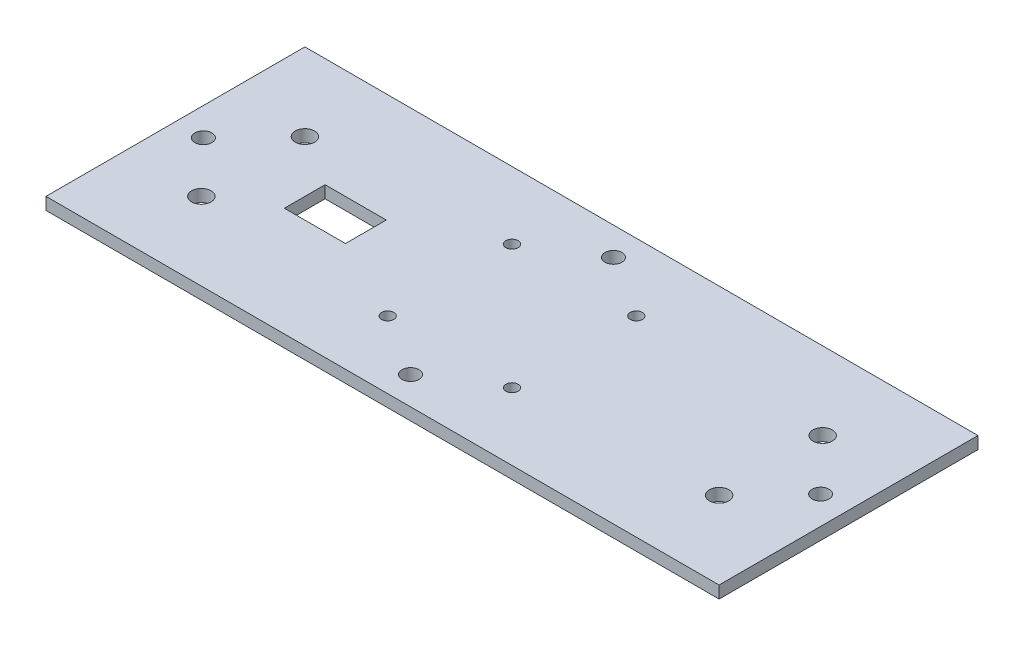
from build123d import *

# Parameters (mm, degrees)
SKETCH1_W           = 165.1
SKETCH1_H           = 63.5
BOSS_EXTRUDE1_DEPTH = 3
CUT_EXTRUDE1_REACH  = 90.496
SKETCH6_R           = 1.5
SKETCH6_W           = 15
SKETCH6_H           = 10
CUT_EXTRUDE3_REACH  = 90.496
SKETCH8_R           = 2.38125
SKETCH9_R           = 2.0828
CUT_EXTRUDE5_DEPTH  = 5.08
SKETCH10_R          = 2.0828
CUT_EXTRUDE6_DEPTH  = 5.08


with BuildPart() as part:
    # Sketch1 → Boss-Extrude1 (new body)
    with BuildSketch(Plane(origin=(0, 0, 0), x_dir=(1, 0, 0), z_dir=(0, 1, 0))):
        Rectangle(SKETCH1_W, SKETCH1_H)
    extrude(amount=BOSS_EXTRUDE1_DEPTH)

    # Sketch6 → Cut-Extrude1 (cut, up to next)
    with BuildSketch(Plane.XZ, mode=Mode.PRIVATE) as cut_extrude1_sk1:
        with Locations(Location((-15.25, 15.25, 0), (0, 0, 270))):
            Circle(SKETCH6_R)
    cut_extrude1_tool1 = extrude(cut_extrude1_sk1.sketch, amount=-CUT_EXTRUDE1_REACH, mode=Mode.PRIVATE) & part.part
    # Sketch6 → Cut-Extrude1 (cut, up to next)
    with BuildSketch(Plane.XZ, mode=Mode.PRIVATE) as cut_extrude1_sk2:
        with Locations(Location((15.25, 15.25, 0), (0, 0, 270))):
            Circle(SKETCH6_R)
    cut_extrude1_tool2 = extrude(cut_extrude1_sk2.sketch, amount=-CUT_EXTRUDE1_REACH, mode=Mode.PRIVATE) & part.part
    # Sketch6 → Cut-Extrude1 (cut, up to next)
    with BuildSketch(Plane.XZ, mode=Mode.PRIVATE) as cut_extrude1_sk3:
        with Locations(Location((-15.25, -15.25, 0), (0, 0, 270))):
            Circle(SKETCH6_R)
    cut_extrude1_tool3 = extrude(cut_extrude1_sk3.sketch, amount=-CUT_EXTRUDE1_REACH, mode=Mode.PRIVATE) & part.part
    # Sketch6 → Cut-Extrude1 (cut, up to next)
    with BuildSketch(Plane.XZ, mode=Mode.PRIVATE) as cut_extrude1_sk4:
        with Locations(Location((15.25, -15.25, 0), (0, 0, 270))):
            Circle(SKETCH6_R)
    cut_extrude1_tool4 = extrude(cut_extrude1_sk4.sketch, amount=-CUT_EXTRUDE1_REACH, mode=Mode.PRIVATE) & part.part
    # Sketch6 → Cut-Extrude1 (cut, up to next)
    with BuildSketch(Plane.XZ, mode=Mode.PRIVATE) as cut_extrude1_sk5:
        with Locations((-43.3, 0.047)):
            Rectangle(SKETCH6_W, SKETCH6_H)
    cut_extrude1_tool5 = extrude(cut_extrude1_sk5.sketch, amount=-CUT_EXTRUDE1_REACH, mode=Mode.PRIVATE) & part.part
    add(cut_extrude1_tool1.solids().sort_by_distance((-15.25, 0, 15.25))[0], mode=Mode.SUBTRACT)
    add(cut_extrude1_tool2.solids().sort_by_distance((15.25, 0, 15.25))[0], mode=Mode.SUBTRACT)
    add(cut_extrude1_tool3.solids().sort_by_distance((-15.25, 0, -15.25))[0], mode=Mode.SUBTRACT)
    add(cut_extrude1_tool4.solids().sort_by_distance((15.25, 0, -15.25))[0], mode=Mode.SUBTRACT)
    add(cut_extrude1_tool5.solids().sort_by_distance((-43.3, 0, 0.047))[0], mode=Mode.SUBTRACT)

    # Sketch8 → Cut-Extrude3 (cut, up to next)
    with BuildSketch(Plane(origin=(0, 3, 0), x_dir=(1, 0, 0), z_dir=(0, 1, 0)), mode=Mode.PRIVATE) as cut_extrude3_sk1:
        with Locations(Location((-63.5, -12.7, 0), (0, 0, 270))):
            Circle(SKETCH8_R)
    cut_extrude3_tool1 = extrude(cut_extrude3_sk1.sketch, amount=-CUT_EXTRUDE3_REACH, mode=Mode.PRIVATE) & part.part
    # Sketch8 → Cut-Extrude3 (cut, up to next)
    with BuildSketch(Plane(origin=(0, 3, 0), x_dir=(1, 0, 0), z_dir=(0, 1, 0)), mode=Mode.PRIVATE) as cut_extrude3_sk2:
        with Locations(Location((-63.5, 12.7, 0), (0, 0, 270))):
            Circle(SKETCH8_R)
    cut_extrude3_tool2 = extrude(cut_extrude3_sk2.sketch, amount=-CUT_EXTRUDE3_REACH, mode=Mode.PRIVATE) & part.part
    # Sketch8 → Cut-Extrude3 (cut, up to next)
    with BuildSketch(Plane(origin=(0, 3, 0), x_dir=(1, 0, 0), z_dir=(0, 1, 0)), mode=Mode.PRIVATE) as cut_extrude3_sk3:
        with Locations(Location((63.5, 12.7, 0), (0, 0, 270))):
            Circle(SKETCH8_R)
    cut_extrude3_tool3 = extrude(cut_extrude3_sk3.sketch, amount=-CUT_EXTRUDE3_REACH, mode=Mode.PRIVATE) & part.part
    # Sketch8 → Cut-Extrude3 (cut, up to next)
    with BuildSketch(Plane(origin=(0, 3, 0), x_dir=(1, 0, 0), z_dir=(0, 1, 0)), mode=Mode.PRIVATE) as cut_extrude3_sk4:
        with Locations(Location((63.5, -12.7, 0), (0, 0, 270))):
            Circle(SKETCH8_R)
    cut_extrude3_tool4 = extrude(cut_extrude3_sk4.sketch, amount=-CUT_EXTRUDE3_REACH, mode=Mode.PRIVATE) & part.part
    add(cut_extrude3_tool1.solids().sort_by_distance((-63.5, 3, 12.7))[0], mode=Mode.SUBTRACT)
    add(cut_extrude3_tool2.solids().sort_by_distance((-63.5, 3, -12.7))[0], mode=Mode.SUBTRACT)
    add(cut_extrude3_tool3.solids().sort_by_distance((63.5, 3, -12.7))[0], mode=Mode.SUBTRACT)
    add(cut_extrude3_tool4.solids().sort_by_distance((63.5, 3, 12.7))[0], mode=Mode.SUBTRACT)

    # Sketch9 → Cut-Extrude5 (cut)
    with BuildSketch(Plane(origin=(0, 3, 0), x_dir=(1, 0, 0), z_dir=(0, 1, 0))):
        with Locations(Location((-75.692, 0, 0), (0, 0, 270))):
            Circle(SKETCH9_R)
        with Locations(Location((75.692, 0, 0), (0, 0, 270))):
            Circle(SKETCH9_R)
    extrude(amount=-CUT_EXTRUDE5_DEPTH, mode=Mode.SUBTRACT)

    # Sketch10 → Cut-Extrude6 (cut)
    with BuildSketch(Plane(origin=(0, 3, 0), x_dir=(1, 0, 0), z_dir=(0, 1, 0))):
        with Locations(Location((0, -24.892, 0), (0, 0, 270))):
            Circle(SKETCH10_R)
        with Locations(Location((0, 24.892, 0), (0, 0, 270))):
            Circle(SKETCH10_R)
    extrude(amount=-CUT_EXTRUDE6_DEPTH, mode=Mode.SUBTRACT)


solid = part.part
